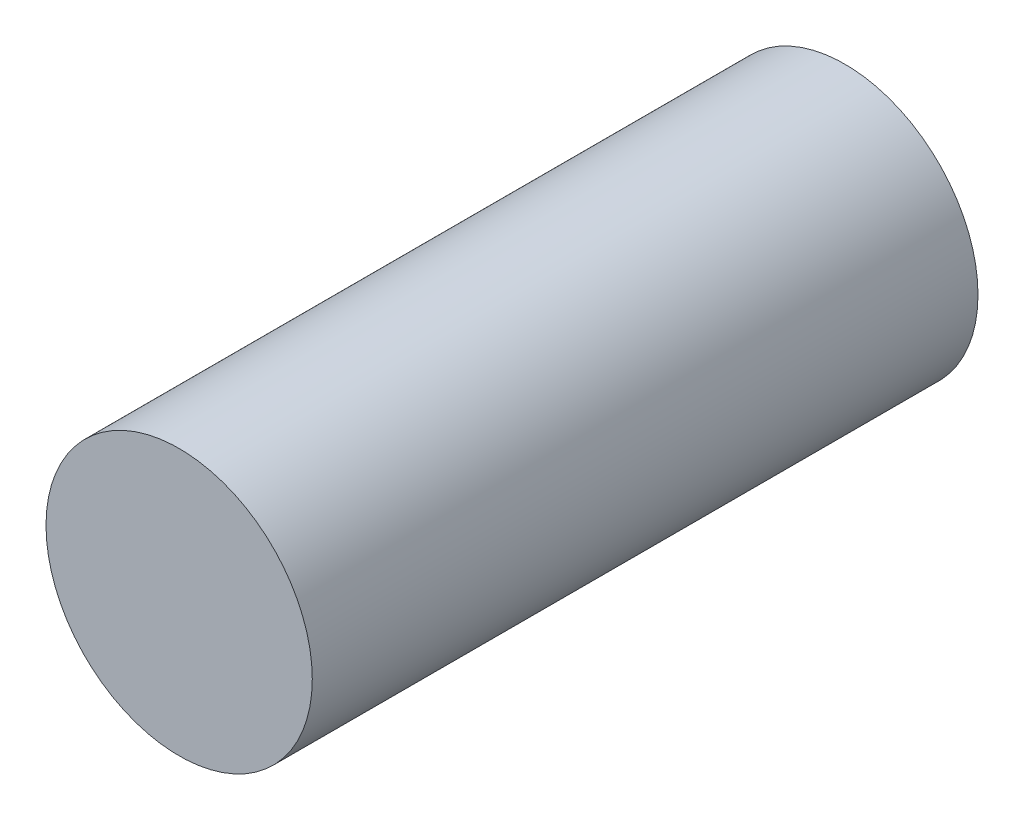
from build123d import *

# Parameters (mm, degrees)
TOPPING_KAT1_KAPAK_PIMI_D8_1_START = -40
SKETCH1_R                          = 4
TOPPING_KAT1_KAPAK_PIMI_D8_1_DEPTH = 20


with BuildPart() as part:
    # Sketch1 → TOPPING_kat1_kapak_pimi_D8_1 (new body)
    with BuildSketch(Plane.XY.offset(TOPPING_KAT1_KAPAK_PIMI_D8_1_START)):
        with Locations((300, 1744)):
            Circle(SKETCH1_R)
    extrude(amount=-TOPPING_KAT1_KAPAK_PIMI_D8_1_DEPTH)


solid = part.part
